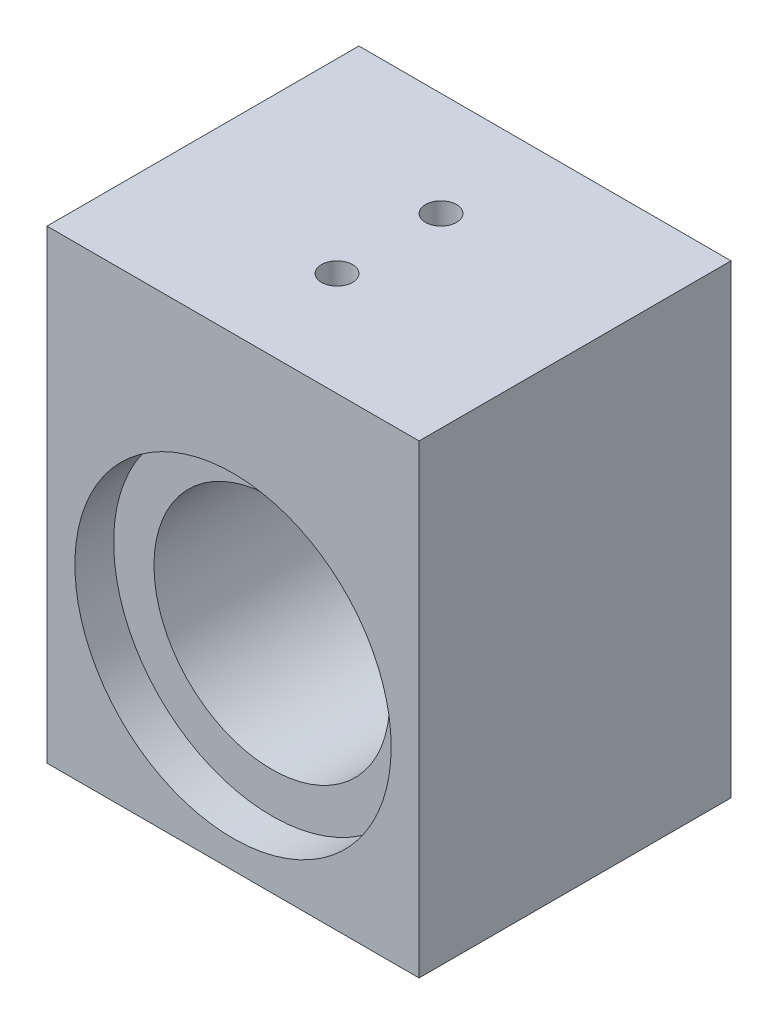
from build123d import *

# Parameters (mm, degrees)
SKETCH1_W           = 15.24
SKETCH1_H           = 19.05
SKETCH1_R           = 3.302
BOSS_EXTRUDE1_DEPTH = 12.7762
CUT_EXTRUDE1_START  = -9.6012
SKETCH2_R           = 4.826
SKETCH2_R_2         = 3.302
CUT_EXTRUDE1_DEPTH  = 9.6012
SKETCH4_R           = 6.477
CUT_EXTRUDE4_DEPTH  = 1.5875
SKETCH5_R           = 0.635
CUT_EXTRUDE5_DEPTH  = 2.54


with BuildPart() as part:
    # Sketch1 → Boss-Extrude1 (new body)
    with BuildSketch(Plane.XY):
        with Locations((7.62, 9.525)):
            Rectangle(SKETCH1_W, SKETCH1_H)
        with Locations((7.62, 7.62)):
            Circle(SKETCH1_R, mode=Mode.SUBTRACT)
    extrude(amount=BOSS_EXTRUDE1_DEPTH)

    # Sketch2 → Cut-Extrude1 (cut)
    with BuildSketch(Plane.XY.offset(12.7762).offset(CUT_EXTRUDE1_START)):
        with Locations((7.62, 7.62)):
            Circle(SKETCH2_R)
        with Locations(Location((7.62, 7.62, 0), (0, 0, 180))):
            Circle(SKETCH2_R_2, mode=Mode.SUBTRACT)
    extrude(amount=CUT_EXTRUDE1_DEPTH, mode=Mode.SUBTRACT)

    # Sketch4 → Cut-Extrude4 (cut)
    with BuildSketch(Plane.XY.offset(12.7762)):
        with Locations((7.62, 7.62)):
            Circle(SKETCH4_R)
    extrude(amount=-CUT_EXTRUDE4_DEPTH, mode=Mode.SUBTRACT)

    # Sketch5 → Cut-Extrude5 (cut)
    with BuildSketch(Plane(origin=(0, 19.05, 0), x_dir=(1, 0, 0), z_dir=(0, 1, 0))):
        with Locations(Location((7.62, -8.517466667, 0), (0, 0, 270))):
            Circle(SKETCH5_R)
        with Locations(Location((7.62, -4.258733333, 0), (0, 0, 270))):
            Circle(SKETCH5_R)
    extrude(amount=-CUT_EXTRUDE5_DEPTH, mode=Mode.SUBTRACT)


solid = part.part
